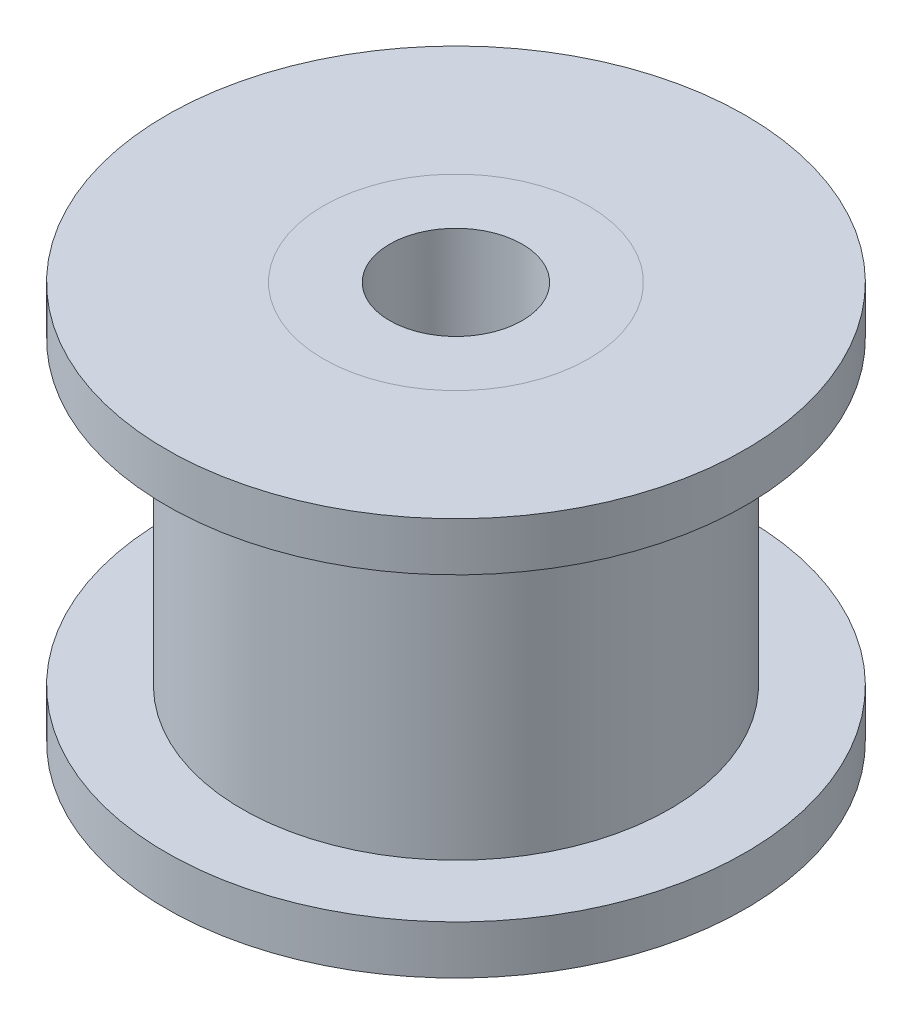
from build123d import *

# Parameters (mm, degrees)
ESQUISSE3_R        = 3
ESQUISSE3_R_2      = 1.5
BOSS_EXTRU_1_DEPTH = 3


with BuildPart() as part:
    # Esquisse2 → Révolution1 (revolve)
    with BuildSketch(Plane.XY, mode=Mode.PRIVATE) as r_volution1_sk:
        Polygon((2, 1.5), (3, 1.5), (3, 4.5), (6.55, 4.5), (6.55, 3.4), (4.84, 3.4), (4.84, -3.4), (6.55, -3.4), (6.55, -4.5), (3, -4.5), (3, -1.5), (2, -1.5), align=None)
    revolve(r_volution1_sk.sketch.rotate(Axis((0, 0, 0), (0, 1, 0)), 90), axis=Axis((0, 0, 0), (0, 1, 0)))


with BuildPart() as body_2:
    # Esquisse3 → Boss.-Extru.1 (new body)
    with BuildSketch(Plane(origin=(0, -1.5, 0), x_dir=(1, 0, 0), z_dir=(0, 1, 0))):
        with Locations(Location((0, 0, 0), (0, 0, 270))):
            Circle(ESQUISSE3_R)
        with Locations(Location((0, 0, 0), (0, 0, 270))):
            Circle(ESQUISSE3_R_2, mode=Mode.SUBTRACT)
    extrude(amount=-BOSS_EXTRU_1_DEPTH)


with BuildPart() as body_3:
    # Symétrie8: mirrored copy
    add(body_2.part.mirror(Plane.ZX))


solid = Compound([part.part, body_2.part, body_3.part])
